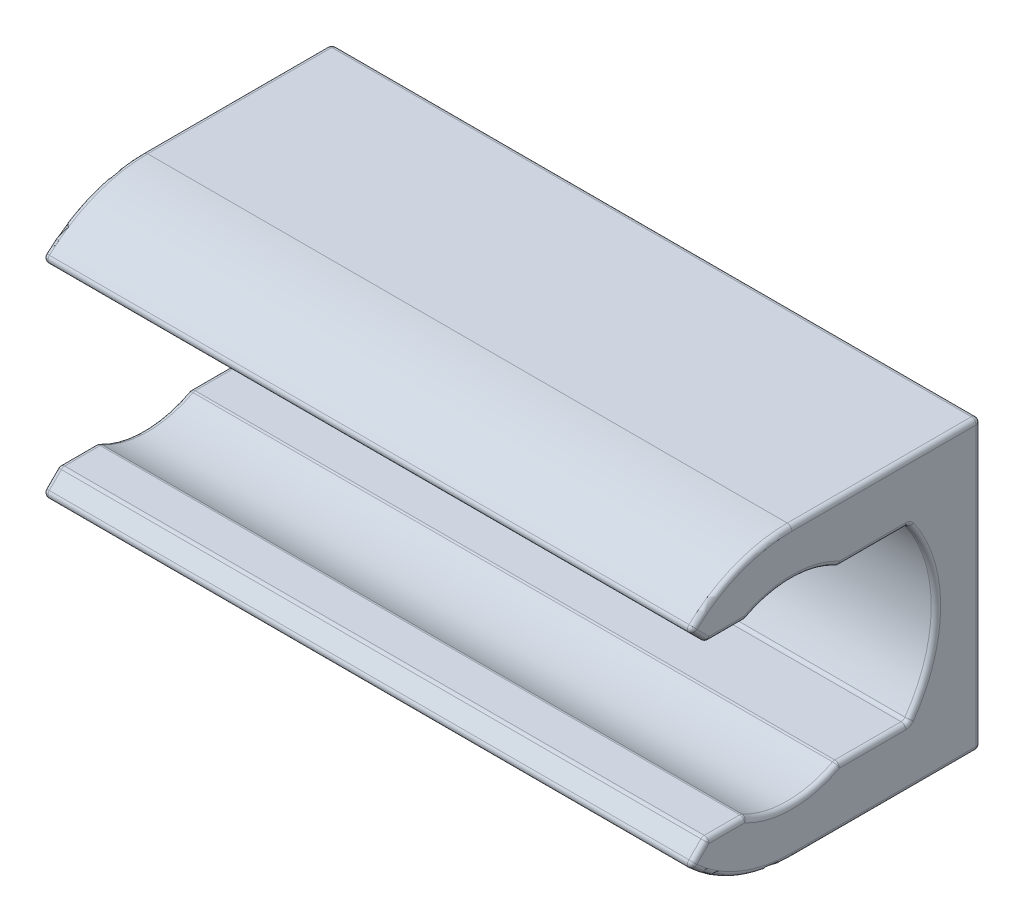
from build123d import *

# Parameters (mm, degrees)
BOSS_EXTRUDE1_DEPTH = 27.5
FILLET1_R           = 0.2


with BuildPart() as part:
    # Sketch1 → Boss-Extrude1 (new body)
    with BuildSketch(Plane(origin=(0, 0, 0), x_dir=(0, 0, -1), z_dir=(1, 0, 0))):
        with BuildLine():
            Line((-4.3133513652379465, 4.313351365237932), (-3.6000000000000107, 3.5999999999999988))
            Line((-3.6000000000000103, 3.5999999999999996), (-1.9621416870348378, 3.5999999999999996))
            ThreePointArc((-1.962141687034841, 3.6000000000000094), (-1.978e-14, 4.1), (1.962141687034806, 3.600000000000028))
            Line((1.9621416870347996, 3.5999999999999996), (4.924428900898164, 3.5999999999999996))
            ThreePointArc((4.9244289008981275, 3.5999999999998975), (4.632641104588721, 3.96845516493194), (4.3133513652379465, 4.313351365237932))
            ThreePointArc((4.3133513652379465, 4.313351365237932), (2.3343689374270524, 5.6356651483188465), (3.7e-16, 6.1))
            ThreePointArc((3.7e-16, 6.1), (-2.334368937427052, 5.6356651483188465), (-4.3133513652379465, 4.313351365237932))
        make_face()
        with BuildLine():
            Line((8, 6.1), (0, 6.1))
            ThreePointArc((3.7e-16, 6.1), (2.3343689374270524, 5.6356651483188465), (4.3133513652379465, 4.313351365237932))
            Line((4.3133513652379465, 4.313351365237932), (8, 4.313351365237933))
            Line((8, 4.313351365237933), (8, 6.1))
        make_face()
        with BuildLine():
            ThreePointArc((4.3133513652379465, 4.313351365237932), (4.632641104588721, 3.96845516493194), (4.9244289008981275, 3.5999999999998975))
            Line((4.924428900898164, 3.5999999999999996), (8, 3.5999999999999996))
            Line((8, 3.5999999999999996), (8, 4.313351365237933))
            Line((8, 4.313351365237933), (4.3133513652379465, 4.313351365237932))
        make_face()
        with BuildLine():
            Line((8, 3.5999999999999996), (4.924428900898164, 3.5999999999999996))
            ThreePointArc((4.9244289008981275, 3.5999999999998975), (5.7986643417031205, 1.8935395037497136), (6.1, 0))
            ThreePointArc((6.1, -1.49e-15), (5.7986643417031205, -1.8935395037497147), (4.924428900898127, -3.599999999999898))
            Line((4.924428900898162, -3.6), (8, -3.5999999999999996))
            Line((8, -3.5999999999999996), (8, 3.5999999999999996))
        make_face()
        with BuildLine():
            ThreePointArc((4.3133513652379465, -4.313351365237933), (2.334368937427049, -5.635665148318848), (-6.54e-15, -6.1))
            Line((-6.22e-15, -6.1), (8, -6.1))
            Line((8, -6.1), (8, -4.313351365237933))
            Line((8, -4.313351365237933), (4.3133513652379465, -4.313351365237932))
        make_face()
        with BuildLine():
            Line((8, -3.5999999999999996), (4.924428900898162, -3.6))
            ThreePointArc((4.924428900898127, -3.599999999999898), (4.6326411045887195, -3.968455164931942), (4.3133513652379465, -4.313351365237933))
            Line((4.3133513652379465, -4.313351365237932), (8, -4.313351365237933))
            Line((8, -4.313351365237933), (8, -3.5999999999999996))
        make_face()
        with BuildLine():
            Line((-1.9621416870348352, -3.6000000000000005), (-3.6000000000000156, -3.600000000000001))
            Line((-3.600000000000014, -3.6000000000000023), (-4.3133513652379465, -4.313351365237932))
            ThreePointArc((-4.313351365237948, -4.313351365237931), (-2.334368937427056, -5.635665148318846), (-6.54e-15, -6.1))
            ThreePointArc((-6.54e-15, -6.1), (2.334368937427049, -5.635665148318848), (4.3133513652379465, -4.313351365237933))
            ThreePointArc((4.3133513652379465, -4.313351365237933), (4.6326411045887195, -3.968455164931942), (4.924428900898127, -3.599999999999898))
            Line((4.924428900898162, -3.6), (1.9621416870348023, -3.6000000000000005))
            ThreePointArc((1.9621416870348085, -3.6000000000000267), (-1.532e-14, -4.1), (-1.9621416870348387, -3.6000000000000103))
        make_face()
    extrude(amount=BOSS_EXTRUDE1_DEPTH)

    # Fillet1
    fillet1_edges = [part.edges().sort_by_distance(p)[0] for p in [
        (0, -6.1, -3.9999999999999973),
        (0, -5.635665148318846, 2.334368937427055),
        (0, -3.9566756826189673, 3.95667568261898),
        (27.5, 6.1, -4),
        (0, -3.6000000000000005, 2.7810708435174254),
        (0, -4.1000000000000005, 1.654e-14),
        (0, -3.6, -3.443285293966482),
        (0, -6.1e-16, -6.100000000000001),
        (0, 3.6000000000000103, -3.4432852939664738),
        (0, 4.1, 1.982e-14),
        (0, 3.5999999999999996, 2.781070843517424),
        (0, 3.9566756826189655, 3.956675682618979),
        (0, 5.635665148318875, 2.334368937427066),
        (27.5, 5.6356651483188465, 2.334368937427051),
        (0, 6.1, -4),
        (0, 0, -8),
        (27.5, 3.9566756826189655, 3.956675682618979),
        (13.75, -6.1, -8),
        (13.75, -4.313351365237931, 4.313351365237947),
        (13.75, -3.6000000000000014, 3.6000000000000147),
        (13.75, -3.600000000000006, 1.9621416870348367),
        (13.75, -3.600000000000014, -1.9621416870348056),
        (13.75, -3.599999999999949, -4.924428900898144),
        (13.75, 3.599999999999948, -4.924428900898145),
        (13.75, 3.600000000000014, -1.9621416870348032),
        (13.75, 3.600000000000005, 1.9621416870348396),
        (13.75, 3.599999999999999, 3.6000000000000103),
        (13.75, 4.313351365237933, 4.313351365237946),
        (13.75, 6.1, -8),
        (27.5, 3.5999999999999996, 2.781070843517424),
        (27.5, 4.1, 1.982e-14),
        (27.5, 0, -8),
        (27.5, 3.6000000000000103, -3.4432852939664738),
        (27.5, -6.1e-16, -6.100000000000001),
        (27.5, -3.6, -3.443285293966482),
        (27.5, -4.1000000000000005, 1.654e-14),
        (27.5, -3.6000000000000005, 2.7810708435174254),
        (27.5, -3.9566756826189673, 3.95667568261898),
        (27.5, -5.635665148318815, 2.3343689374270387),
        (27.5, -6.1, -3.9999999999999973),
    ]]
    fillet(fillet1_edges, radius=FILLET1_R)


solid = part.part
